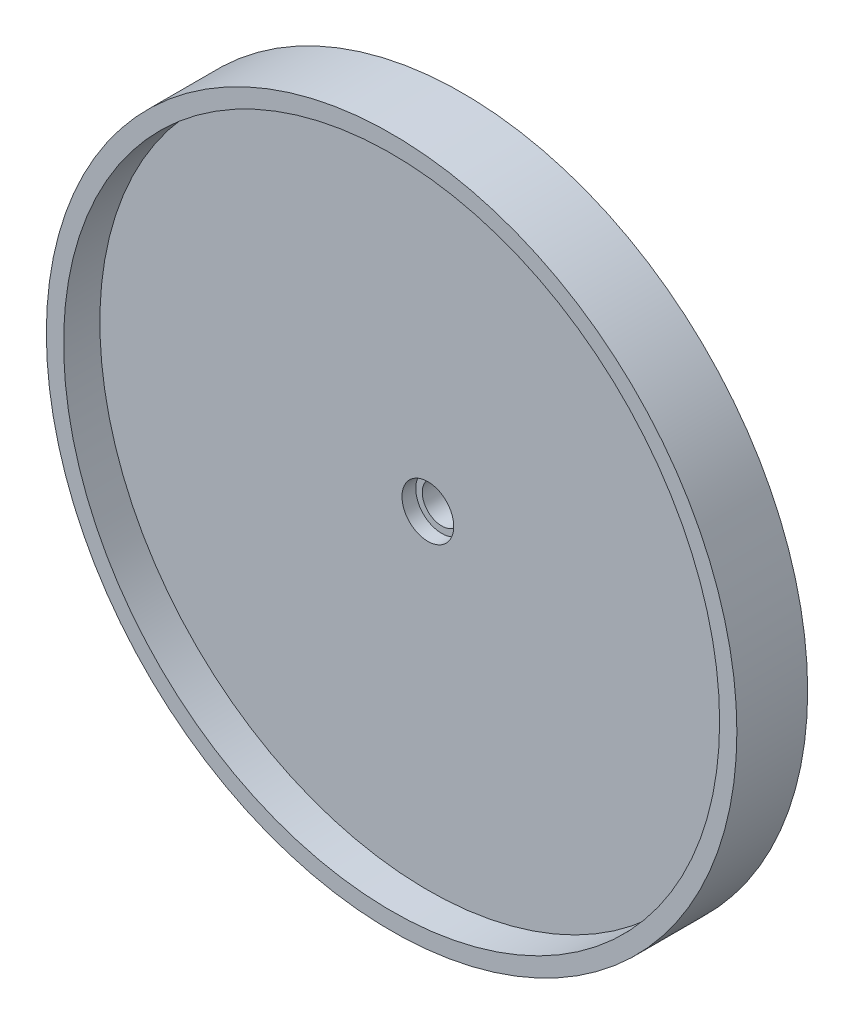
from build123d import *

# Parameters (mm, degrees)
CUT_EXTRUDE1_REACH             = 92.741
SKETCH3_R                      = 3.571875
CUT_EXTRUDE1_DIRECTION_2_DEPTH = 91.741144506
SKETCH4_R                      = 4.7625
CUT_EXTRUDE2_DEPTH             = 2.54


with BuildPart() as part:
    # Sketch2 → Revolve1 (revolve)
    with BuildSketch(Plane(origin=(0, 0, 0), x_dir=(0, 0, -1), z_dir=(1, 0, 0)), mode=Mode.PRIVATE) as revolve1_sk:
        Polygon((0, 63.5), (0, 60.325), (6.6675, 60.325), (6.6675, 0), (13.0175, 0), (13.0175, 63.5), align=None)
    revolve(revolve1_sk.sketch.rotate(Axis((0, 0, 40.533532934), (0, 0, -1)), 90), axis=Axis((0, 0, 40.533532934), (0, 0, -1)))

    # Sketch3 → Cut-Extrude1 (cut, up to next)
    with BuildSketch(Plane(origin=(0, 0, -13.0175), x_dir=(-1, 0, 0), z_dir=(0, 0, -1)), mode=Mode.PRIVATE) as cut_extrude1_sk1:
        with Locations(Location((0, 0, 0), (0, 0, 180))):
            Circle(SKETCH3_R)
    cut_extrude1_tool1 = extrude(cut_extrude1_sk1.sketch, amount=-CUT_EXTRUDE1_REACH, mode=Mode.PRIVATE) & part.part
    add(cut_extrude1_tool1.solids().sort_by_distance((0, 0, -13.0175))[0], mode=Mode.SUBTRACT)

    # Sketch3 → Cut-Extrude1 direction 2 (cut)
    with BuildSketch(Plane(origin=(0, 0, -13.0175), x_dir=(-1, 0, 0), z_dir=(0, 0, -1))):
        with Locations(Location((0, 0, 0), (0, 0, 180))):
            Circle(SKETCH3_R)
    extrude(amount=CUT_EXTRUDE1_DIRECTION_2_DEPTH, mode=Mode.SUBTRACT)

    # Sketch4 → Cut-Extrude2 (cut)
    with BuildSketch(Plane.XY.offset(-6.6675)):
        Circle(SKETCH4_R)
    extrude(amount=-CUT_EXTRUDE2_DEPTH, mode=Mode.SUBTRACT)


solid = part.part
